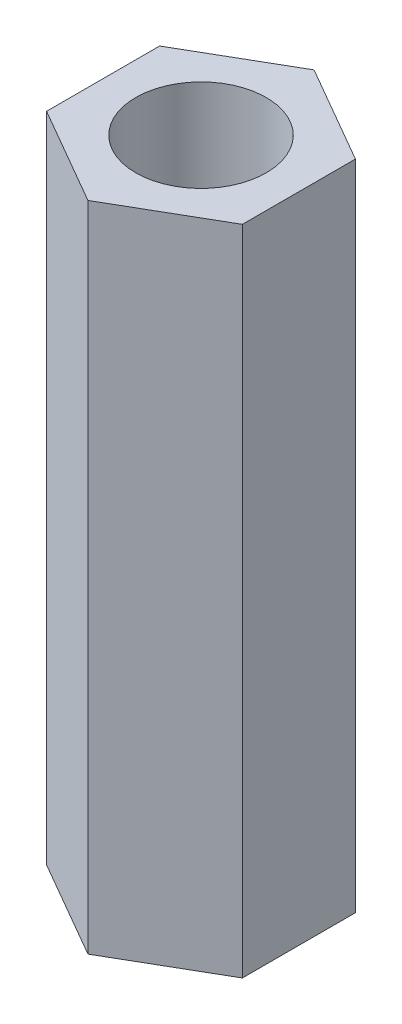
from build123d import *

# Parameters (mm, degrees)
BOSS_EXTRUDE1_DEPTH = 15
SKETCH2_R           = 1.5
CUT_EXTRUDE1_DEPTH  = 16.388713397


with BuildPart() as part:
    # Sketch1 → Boss-Extrude1 (new body)
    with BuildSketch(Plane(origin=(0, 0, 0), x_dir=(1, 0, 0), z_dir=(0, 1, 0))):
        Polygon((0, 2.598076211), (-2.25, 1.299038106), (-2.25, -1.299038106), (0, -2.598076211), (2.25, -1.299038106), (2.25, 1.299038106), align=None)
    extrude(amount=BOSS_EXTRUDE1_DEPTH)

    # Sketch2 → Cut-Extrude1 (cut, through all)
    with BuildSketch(Plane(origin=(0, 15, 0), x_dir=(1, 0, 0), z_dir=(0, 1, 0))):
        with Locations(Location((0, 0, 0), (0, 0, 270))):
            Circle(SKETCH2_R)
    extrude(amount=-CUT_EXTRUDE1_DEPTH, mode=Mode.SUBTRACT)


solid = part.part
